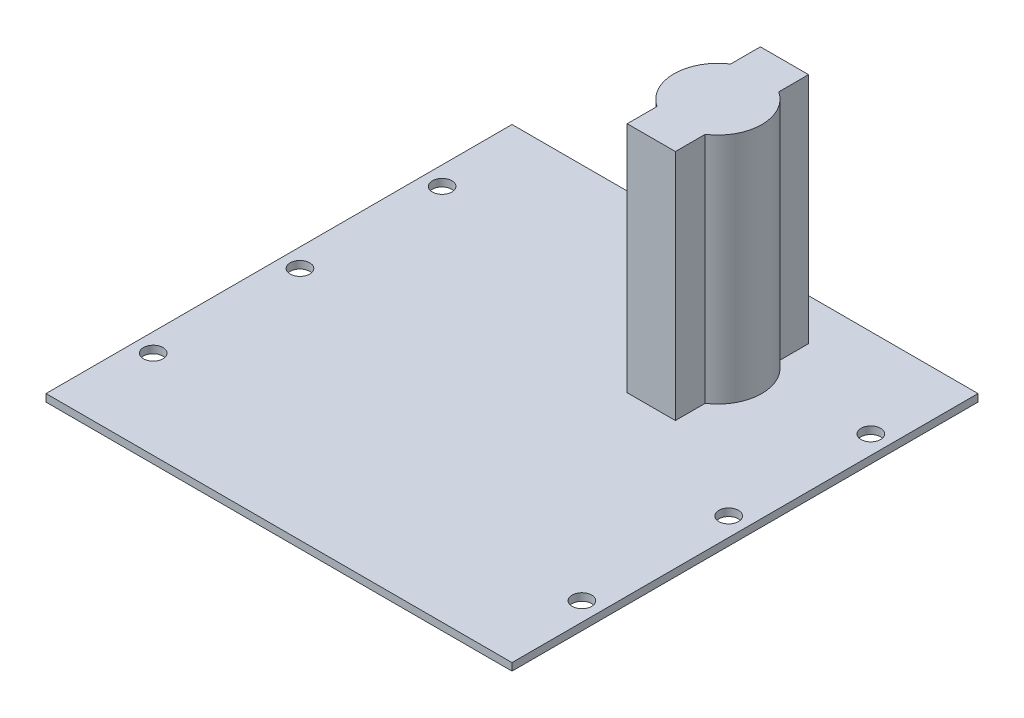
from build123d import *

# Parameters (mm, degrees)
CROQUIS1_W              = 100
CROQUIS1_H              = 100
CROQUIS1_R              = 2.1
SALIENTE_EXTRUIR1_DEPTH = 1.6
SALIENTE_EXTRUIR2_DEPTH = 50


with BuildPart() as part:
    # Croquis1 → Saliente-Extruir1 (new body)
    with BuildSketch(Plane(origin=(0, 0, 0), x_dir=(1, 0, 0), z_dir=(0, 1, 0))):
        Rectangle(CROQUIS1_W, CROQUIS1_H)
        with Locations(Location((-46, 31, 0), (0, 0, 270))):
            Circle(CROQUIS1_R, mode=Mode.SUBTRACT)
        with Locations(Location((-46, 0.5, 0), (0, 0, 270))):
            Circle(CROQUIS1_R, mode=Mode.SUBTRACT)
        with Locations(Location((-46, -31, 0), (0, 0, 270))):
            Circle(CROQUIS1_R, mode=Mode.SUBTRACT)
        with Locations(Location((46, -31, 0), (0, 0, 90))):
            Circle(CROQUIS1_R, mode=Mode.SUBTRACT)
        with Locations(Location((46, 0.5, 0), (0, 0, 90))):
            Circle(CROQUIS1_R, mode=Mode.SUBTRACT)
        with Locations(Location((46, 31, 0), (0, 0, 90))):
            Circle(CROQUIS1_R, mode=Mode.SUBTRACT)
    extrude(amount=SALIENTE_EXTRUIR1_DEPTH)

    # Croquis2 → Saliente-Extruir2 (add)
    with BuildSketch(Plane(origin=(0, 1.6, 0), x_dir=(1, 0, 0), z_dir=(0, 1, 0))):
        with BuildLine():
            Line((12.217414709, 18.903028856), (12.217414709, 34.689006191))
            ThreePointArc((12.217414709, 34.689006191), (7.951157107, 26.796017524), (12.217414709, 18.903028856))
        make_face()
        with BuildLine():
            ThreePointArc((22.553948572, 34.689006191), (17.38568164, 36.230542057), (12.217414709, 34.689006191))
            Line((12.217414709, 34.689006191), (12.217414709, 18.903028856))
            ThreePointArc((12.217414709, 18.903028856), (17.38568164, 17.36149299), (22.553948572, 18.903028856))
            Line((22.553948572, 18.903028856), (22.553948572, 34.689006191))
        make_face()
        with BuildLine():
            Line((22.553948572, 41.084489345), (12.217414709, 41.084489345))
            Line((12.217414709, 41.084489345), (12.217414709, 34.689006191))
            ThreePointArc((12.217414709, 34.689006191), (17.38568164, 36.230542057), (22.553948572, 34.689006191))
            Line((22.553948572, 34.689006191), (22.553948572, 41.084489345))
        make_face()
        with BuildLine():
            ThreePointArc((26.820206174, 26.796017524), (25.685392308, 31.282113377), (22.553948572, 34.689006191))
            Line((22.553948572, 34.689006191), (22.553948572, 18.903028856))
            ThreePointArc((22.553948572, 18.903028856), (25.685392308, 22.30992167), (26.820206174, 26.796017524))
        make_face()
        with BuildLine():
            ThreePointArc((22.553948572, 18.903028856), (17.38568164, 17.36149299), (12.217414709, 18.903028856))
            Line((12.217414709, 18.903028856), (12.217414709, 12.507545702))
            Line((12.217414709, 12.507545702), (22.553948572, 12.507545702))
            Line((22.553948572, 12.507545702), (22.553948572, 18.903028856))
        make_face()
    extrude(amount=SALIENTE_EXTRUIR2_DEPTH)


solid = part.part
